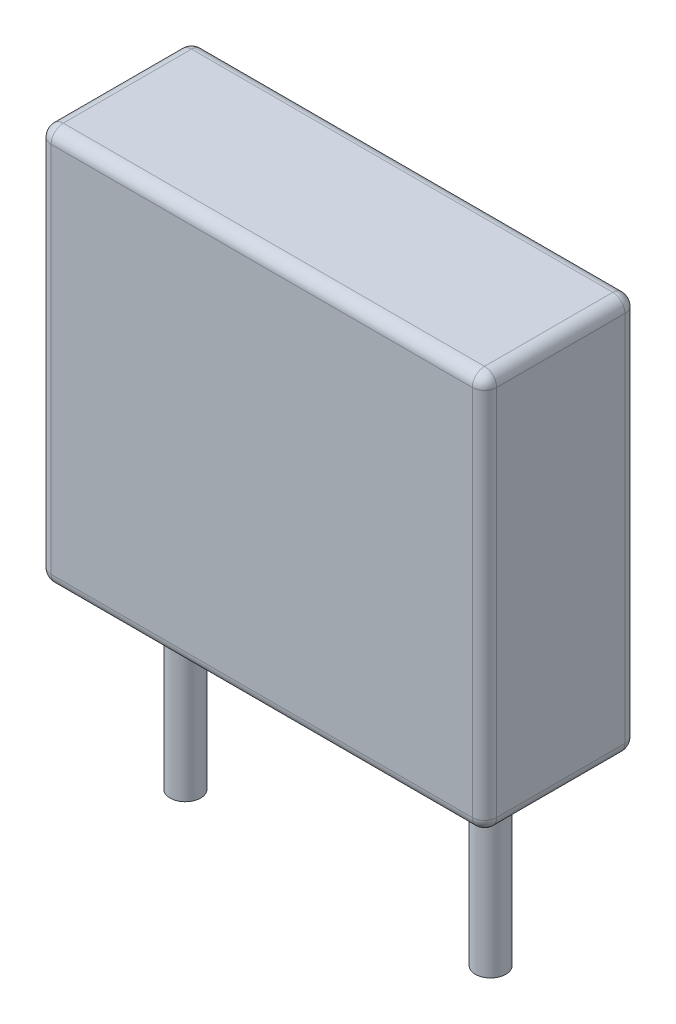
from build123d import *

# Parameters (mm, degrees)
SKETCH1_W             = 7.3
SKETCH1_H             = 2.5
BOSS_EXTRUDE1_DEPTH   = 6.5
SKETCH2_R             = 0.25
BOSS_EXTRUDE2_DEPTH   = 3
BOSS_EXTRUDE2_2_DEPTH = 3
FILLET1_R             = 0.2


with BuildPart() as part:
    # Sketch1 → Boss-Extrude1 (new body)
    with BuildSketch(Plane(origin=(0, 0, 0), x_dir=(1, 0, 0), z_dir=(0, 1, 0))):
        Rectangle(SKETCH1_W, SKETCH1_H)
    extrude(amount=BOSS_EXTRUDE1_DEPTH)

    # Fillet1
    fillet1_edges = [part.edges().sort_by_distance(p)[0] for p in [
        (3.65, 6.5, 0),
        (0, 6.5, -1.25),
        (-3.65, 6.5, 0),
        (0, 0, -1.25),
        (3.65, 0, 0),
        (0, 0, 1.25),
        (-3.65, 0, 0),
        (-3.65, 3.25, -1.25),
        (3.65, 3.25, -1.25),
        (3.65, 3.25, 1.25),
        (-3.65, 3.25, 1.25),
        (0, 6.5, 1.25),
    ]]
    fillet(fillet1_edges, radius=FILLET1_R)


with BuildPart() as body_2:
    # Sketch2 → Boss-Extrude2 (new body)
    with BuildSketch(Plane(origin=(0, 0, 0), x_dir=(1, 0, 0), z_dir=(0, 1, 0))):
        with Locations(Location((-2.5, 0, 0), (0, 0, 270))):
            Circle(SKETCH2_R)
    extrude(amount=-BOSS_EXTRUDE2_DEPTH)


with BuildPart() as body_3:
    # Sketch2 → Boss-Extrude2 2 (new body)
    with BuildSketch(Plane(origin=(0, 0, 0), x_dir=(1, 0, 0), z_dir=(0, 1, 0))):
        with Locations(Location((2.5, 0, 0), (0, 0, 270))):
            Circle(SKETCH2_R)
    extrude(amount=-BOSS_EXTRUDE2_2_DEPTH)


solid = Compound([part.part, body_2.part, body_3.part])
